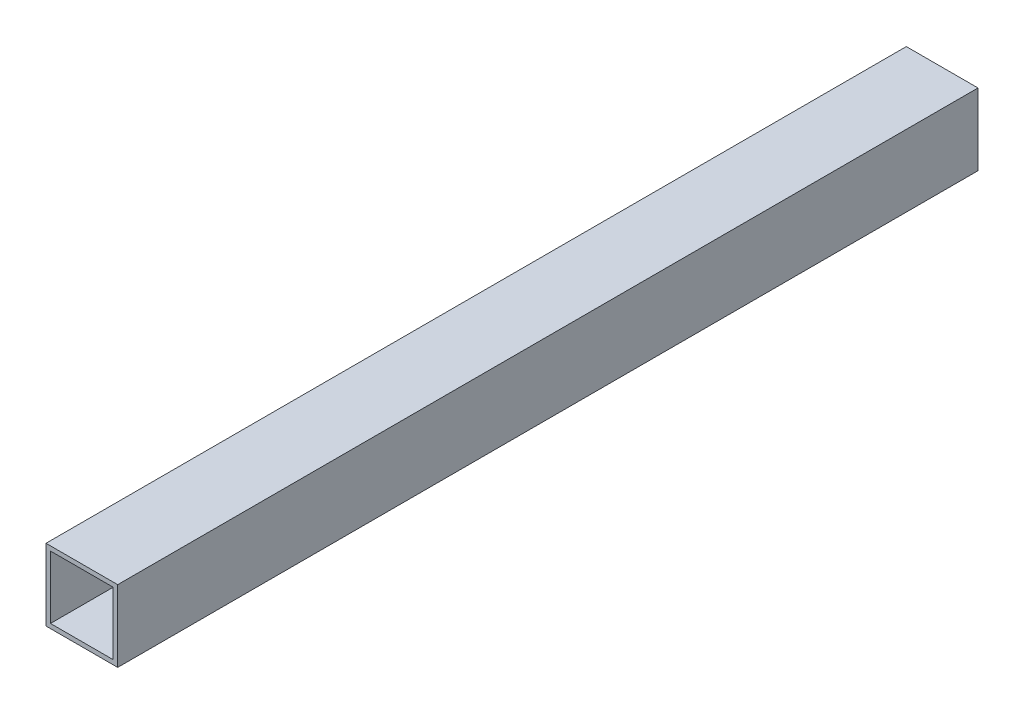
from build123d import *

# Parameters (mm, degrees)
SKETCH1_W           = 25.4
SKETCH1_H           = 25.4
SKETCH1_W_2         = 22.225
SKETCH1_H_2         = 22.225
BOSS_EXTRUDE1_DEPTH = 304.8


with BuildPart() as part:
    # Sketch1 → Boss-Extrude1 (new body)
    with BuildSketch(Plane.XY):
        Rectangle(SKETCH1_W, SKETCH1_H)
        Rectangle(SKETCH1_W_2, SKETCH1_H_2, mode=Mode.SUBTRACT)
    extrude(amount=BOSS_EXTRUDE1_DEPTH)


solid = part.part
